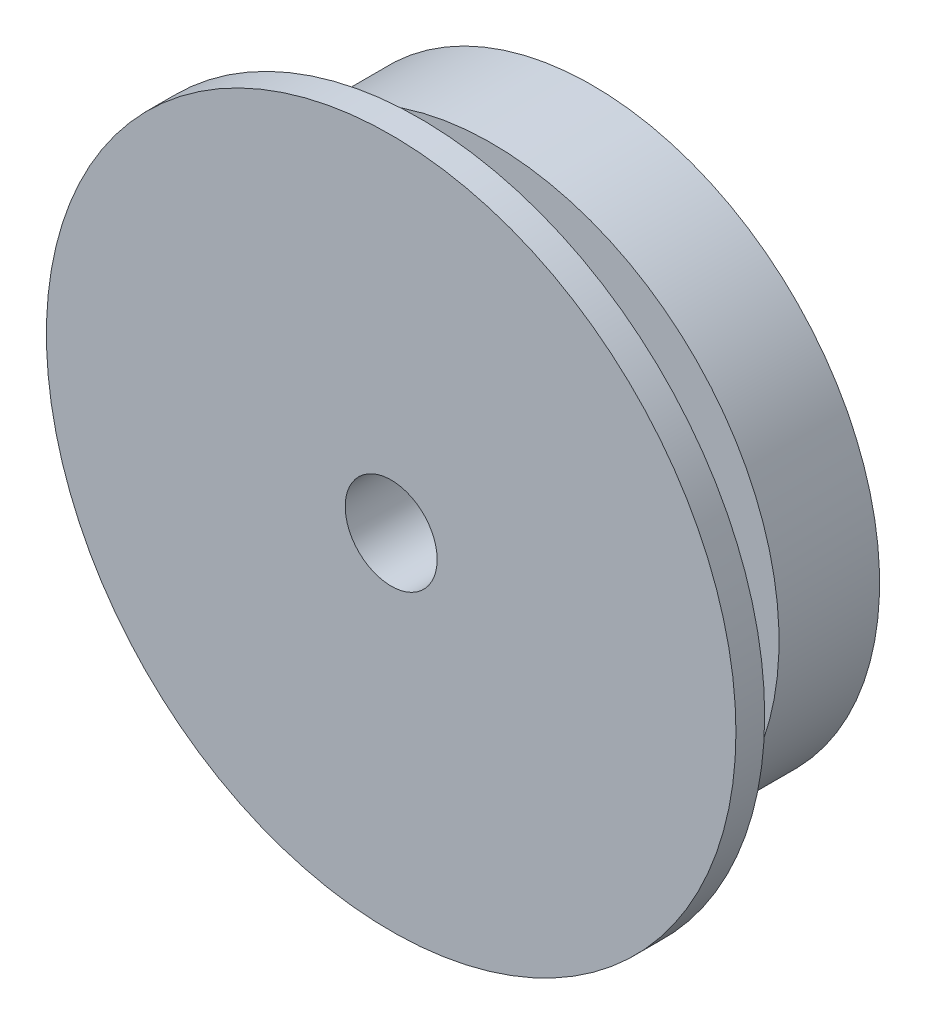
from build123d import *

# Parameters (mm, degrees)
CROQUIS1_R              = 25
CROQUIS1_R_2            = 11
SALIENTE_EXTRUIR1_DEPTH = 19
CROQUIS3_R              = 11
CROQUIS3_R_2            = 9.5
SALIENTE_EXTRUIR2_DEPTH = 13
SALIENTE_EXTRUIR3_START = -2
CROQUIS4_R              = 11
CROQUIS4_R_2            = 4
SALIENTE_EXTRUIR3_DEPTH = 2
SALIENTE_EXTRUIR4_START = -2.5
CROQUIS5_R              = 30
CROQUIS5_R_2            = 25
SALIENTE_EXTRUIR4_DEPTH = 2.5
CORTAR_EXTRUIR1_START   = 4
CROQUIS6_R              = 25
CROQUIS6_R_2            = 19
CORTAR_EXTRUIR1_DEPTH   = 4
SALIENTE_EXTRUIR5_REACH = 48.487
CROQUIS7_R              = 11
CROQUIS7_R_2            = 4
SALIENTE_EXTRUIR6_START = 1.5
CROQUIS8_R              = 6.1
CROQUIS8_R_2            = 4
SALIENTE_EXTRUIR6_DEPTH = 1.5
CROQUIS9_R              = 25
CROQUIS9_R_2            = 15
CORTAR_EXTRUIR2_DEPTH   = 1.5


with BuildPart() as part:
    # Croquis1 → Saliente-Extruir1 (new body)
    with BuildSketch(Plane.XY):
        Circle(CROQUIS1_R)
        Circle(CROQUIS1_R_2, mode=Mode.SUBTRACT)
    extrude(amount=SALIENTE_EXTRUIR1_DEPTH)

    # Croquis3 → Saliente-Extruir2 (add, through all)
    with BuildSketch(Plane(origin=(0, 0, 6), x_dir=(-1, 0, 0), z_dir=(0, 0, -1))):
        Circle(CROQUIS3_R)
        Circle(CROQUIS3_R_2, mode=Mode.SUBTRACT)
    extrude(amount=-SALIENTE_EXTRUIR2_DEPTH)

    # Croquis4 → Saliente-Extruir3 (add)
    with BuildSketch(Plane.XY.offset(19).offset(SALIENTE_EXTRUIR3_START)):
        with Locations(Location((0, 0, 0), (0, 0, 180))):
            Circle(CROQUIS4_R)
        Circle(CROQUIS4_R_2, mode=Mode.SUBTRACT)
    extrude(amount=SALIENTE_EXTRUIR3_DEPTH)

    # Croquis5 → Saliente-Extruir4 (add)
    with BuildSketch(Plane.XY.offset(19).offset(SALIENTE_EXTRUIR4_START)):
        Circle(CROQUIS5_R)
        Circle(CROQUIS5_R_2, mode=Mode.SUBTRACT)
    extrude(amount=SALIENTE_EXTRUIR4_DEPTH)

    # Croquis6 → Cortar-Extruir1 (cut)
    with BuildSketch(Plane(origin=(0, 0, 14.25), x_dir=(-1, 0, 0), z_dir=(0, 0, -1)).offset(CORTAR_EXTRUIR1_START)):
        Circle(CROQUIS6_R)
        Circle(CROQUIS6_R_2, mode=Mode.SUBTRACT)
    extrude(amount=-CORTAR_EXTRUIR1_DEPTH, mode=Mode.SUBTRACT)

    # Croquis7 → Saliente-Extruir5 (add, up to next)
    with BuildSketch(Plane(origin=(0, 0, 0), x_dir=(-1, 0, 0), z_dir=(0, 0, -1)), mode=Mode.PRIVATE) as saliente_extruir5_sk1:
        Circle(CROQUIS7_R)
        with Locations(Location((0, 0, 0), (0, 0, 180))):
            Circle(CROQUIS7_R_2, mode=Mode.SUBTRACT)
    saliente_extruir5_tool1 = extrude(saliente_extruir5_sk1.sketch, amount=-SALIENTE_EXTRUIR5_REACH, mode=Mode.PRIVATE) - part.part
    add(saliente_extruir5_tool1.solids().sort_by_distance((10.688873, 0, 0))[0])

    # Croquis8 → Saliente-Extruir6 (add)
    with BuildSketch(Plane(origin=(0, 0, 0), x_dir=(-1, 0, 0), z_dir=(0, 0, -1)).offset(SALIENTE_EXTRUIR6_START)):
        with Locations(Location((0, 0, 0), (0, 0, 180))):
            Circle(CROQUIS8_R)
        with Locations(Location((0, 0, 0), (0, 0, 180))):
            Circle(CROQUIS8_R_2, mode=Mode.SUBTRACT)
    extrude(amount=-SALIENTE_EXTRUIR6_DEPTH)

    # Croquis9 → Cortar-Extruir2 (cut)
    with BuildSketch(Plane(origin=(0, 0, 0), x_dir=(-1, 0, 0), z_dir=(0, 0, -1))):
        Circle(CROQUIS9_R)
        Circle(CROQUIS9_R_2, mode=Mode.SUBTRACT)
    extrude(amount=-CORTAR_EXTRUIR2_DEPTH, mode=Mode.SUBTRACT)


solid = part.part
